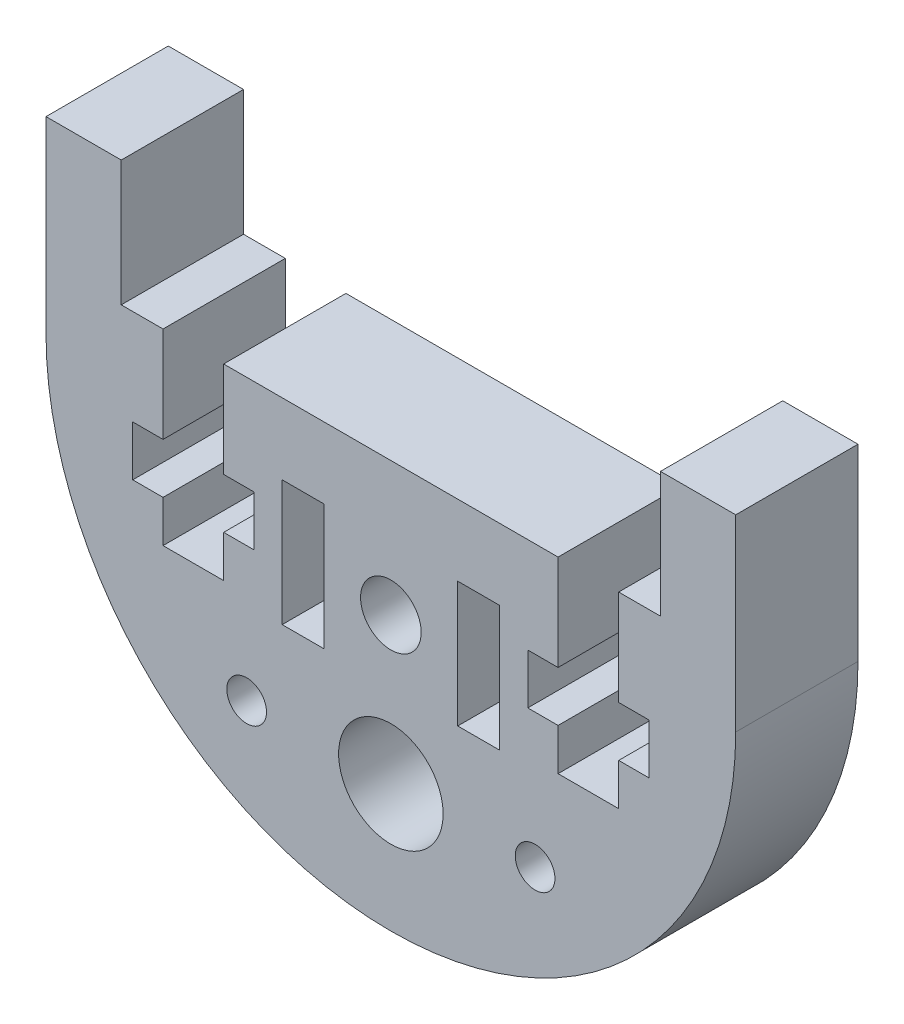
from build123d import *

# Parameters (mm, degrees)
MODEL_R             = 0.95
MODEL_R_2           = 2.5
MODEL_W             = 2
MODEL_H             = 6
MODEL_R_3           = 1.45
BOSS_EXTRUDE2_DEPTH = 5.85


with BuildPart() as part:
    # Model → Boss-Extrude2 (new body)
    with BuildSketch(Plane.XY):
        with BuildLine():
            Line((553.509477136, 560.932469), (545.509477136, 560.932469))
            Line((545.509477136, 560.932469), (545.509477136, 556.356563))
            Line((545.509477136, 556.356563), (546.959477136, 556.356563))
            Line((546.959477136, 556.356563), (546.959477136, 553.956511944))
            Line((546.959477136, 553.956511944), (545.509477136, 553.956511944))
            Line((545.509477136, 553.956511944), (545.509477136, 551.956511944))
            Line((545.509477136, 551.956511944), (542.609477136, 551.956511944))
            Line((542.609477136, 551.956511944), (542.609477136, 553.956511944))
            Line((542.609477136, 553.956511944), (541.159477136, 553.956511944))
            Line((541.159477136, 553.956511944), (541.159477136, 556.356563))
            Line((541.159477136, 556.356563), (542.609477136, 556.356563))
            Line((542.609477136, 556.356563), (542.609477136, 560.932469))
            Line((542.609477136, 560.932469), (540.609477136, 560.932469))
            Line((540.609477136, 560.932469), (540.609477136, 566.932469))
            Line((540.609477136, 566.932469), (537.009477136, 566.932469))
            Line((537.009477136, 566.932469), (537.009477136, 557.932469))
            ThreePointArc((537.009477136, 557.932469), (553.509477136, 541.432469), (570.009477136, 557.932469))
            Line((570.009477136, 557.932469), (570.009477136, 566.932469))
            Line((570.009477136, 566.932469), (566.409477136, 566.932469))
            Line((566.409477136, 566.932469), (566.409477136, 560.932469))
            Line((566.409477136, 560.932469), (564.409477136, 560.932469))
            Line((564.409477136, 560.932469), (564.409477136, 556.356563))
            Line((564.409477136, 556.356563), (565.859477136, 556.356563))
            Line((565.859477136, 556.356563), (565.859477136, 553.956511944))
            Line((565.859477136, 553.956511944), (564.409477136, 553.956511944))
            Line((564.409477136, 553.956511944), (564.409477136, 551.956511944))
            Line((564.409477136, 551.956511944), (561.509477136, 551.956511944))
            Line((561.509477136, 551.956511944), (561.509477136, 553.956511944))
            Line((561.509477136, 553.956511944), (560.059477136, 553.956511944))
            Line((560.059477136, 553.956511944), (560.059477136, 556.356563))
            Line((560.059477136, 556.356563), (561.509477136, 556.356563))
            Line((561.509477136, 556.356563), (561.509477136, 560.932469))
            Line((561.509477136, 560.932469), (553.509477136, 560.932469))
        make_face()
        with Locations((546.609477136, 547.532469)):
            Circle(MODEL_R, mode=Mode.SUBTRACT)
        with Locations((553.509477136, 547.532469)):
            Circle(MODEL_R_2, mode=Mode.SUBTRACT)
        with Locations((560.409477136, 547.532469)):
            Circle(MODEL_R, mode=Mode.SUBTRACT)
        with Locations((549.309477136, 554.532469)):
            Rectangle(MODEL_W, MODEL_H, mode=Mode.SUBTRACT)
        with Locations((553.509477136, 554.532469)):
            Circle(MODEL_R_3, mode=Mode.SUBTRACT)
        with Locations((557.709477136, 554.532469)):
            Rectangle(MODEL_W, MODEL_H, mode=Mode.SUBTRACT)
    extrude(amount=BOSS_EXTRUDE2_DEPTH)


solid = part.part
